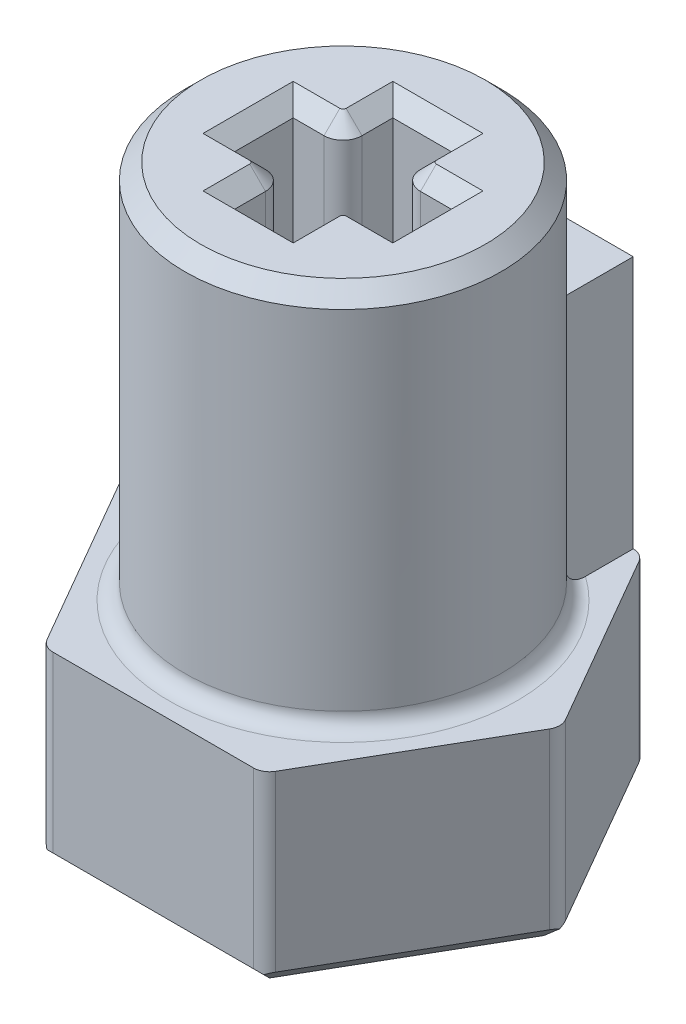
from build123d import *

# Parameters (mm, degrees)
SKETCH_1_R          = 5
EXTRUDE_4_DEPTH     = 12
FILLET_1_R          = 0.6
FILLET_2_R          = 0.6
EXTRUDE_5_DEPTH     = 6
SKETCH_3_R          = 2.55
CUT_EXTRUDE_1_DEPTH = 6
CHAMFER_1_SIZE      = 0.5
CHAMFER_4_SIZE      = 0.5
FILLET_4_R          = 0.5
FILLET_5_R          = 0.5
SKETCH_4_W          = 6.329239392
SKETCH_4_H          = 8
EXTRUDE_6_DEPTH     = 3.5
SKETCH_5_R          = 1.2
CUT_EXTRUDE_2_DEPTH = 3.5
FILLET_7_R          = 0.5


with BuildPart() as part:
    # ｽｹｯﾁ1 → ﾎﾞｽ - 押し出し4 (new body)
    with BuildSketch(Plane(origin=(0, 0, 0), x_dir=(1, 0, 0), z_dir=(0, 1, 0))):
        with Locations(Location((0, 0, 0), (0, 0, 270))):
            Circle(SKETCH_1_R)
        Polygon((-2.5, -0.925), (-2.5, 0.925), (-0.925, 0.925), (-0.925, 2.5), (0.925, 2.5), (0.925, 0.925), (2.5, 0.925), (2.5, -0.925), (0.925, -0.925), (0.925, -2.5), (-0.925, -2.5), (-0.925, -0.925), align=None, mode=Mode.SUBTRACT)
    extrude(amount=EXTRUDE_4_DEPTH)

    # ﾌｨﾚｯﾄ1
    fillet_1_edges = [part.edges().sort_by_distance(p)[0] for p in [
        (0.925, 6, -0.925),
    ]]
    fillet(fillet_1_edges, radius=FILLET_1_R)

    # ﾌｨﾚｯﾄ2
    fillet_2_edges = [part.edges().sort_by_distance(p)[0] for p in [
        (-0.925, 6, -0.925),
        (-0.925, 6, 0.925),
        (0.925, 6, 0.925),
    ]]
    fillet(fillet_2_edges, radius=FILLET_2_R)

    # ｽｹｯﾁ2 → ﾎﾞｽ - 押し出し5 (add)
    with BuildSketch(Plane.XZ):
        Polygon((6.92820323, 0), (3.464101615, 6), (-3.464101615, 6), (-6.92820323, 0), (-3.464101615, -6), (3.464101615, -6), align=None)
    extrude(amount=EXTRUDE_5_DEPTH)

    # ｽｹｯﾁ3 → ｶｯﾄ - 押し出し1 (cut)
    with BuildSketch(Plane.XZ.offset(6)):
        with Locations(Location((0, 0, 0), (0, 0, 270))):
            Circle(SKETCH_3_R)
    extrude(amount=-CUT_EXTRUDE_1_DEPTH, mode=Mode.SUBTRACT)

    # 面取り1
    chamfer_1_edges = [part.edges().sort_by_distance(p)[0] for p in [
        (0, -6, 2.55),
        (5.196152423, -6, -3),
        (5.196152423, -6, 3),
        (0, -6, 6),
        (-5.196152423, -6, 3),
        (-5.196152423, -6, -3),
        (0, -6, -6),
    ]]
    chamfer(chamfer_1_edges, length=CHAMFER_1_SIZE)

    # 面取り4
    chamfer_4_edges = [part.edges().sort_by_distance(p)[0] for p in [
        (2.5, 12, 0),
        (-2.0125, 12, -0.925),
        (-2.0125, 12, 0.925),
        (-2.5, 12, 0),
        (0, 12, -5),
        (2.0125, 12, -0.925),
        (1.100735931, 12, -1.100735931),
        (-0.925, 12, 2.0125),
        (2.0125, 12, 0.925),
        (0.925, 12, 2.0125),
        (1.100735931, 12, 1.100735931),
        (-1.100735931, 12, -1.100735931),
        (-1.100735931, 12, 1.100735931),
        (0.925, 12, -2.0125),
        (0, 12, -2.5),
        (0, 12, 2.5),
        (-0.925, 12, -2.0125),
    ]]
    chamfer(chamfer_4_edges, length=CHAMFER_4_SIZE)

    # ﾌｨﾚｯﾄ4
    fillet_4_edges = [part.edges().sort_by_distance(p)[0] for p in [
        (-3.464101615, -2.75, 6),
    ]]
    fillet(fillet_4_edges, radius=FILLET_4_R)

    # ﾌｨﾚｯﾄ5
    fillet_5_edges = [part.edges().sort_by_distance(p)[0] for p in [
        (3.464101615, -2.75, -6),
        (-3.464101615, -2.75, -6),
        (-6.92820323, -2.75, 0),
        (3.464101615, -2.75, 6),
        (6.92820323, -2.75, 0),
    ]]
    fillet(fillet_5_edges, radius=FILLET_5_R)

    # ｽｹｯﾁ4 → ﾎﾞｽ - 押し出し6 (add)
    with BuildSketch(Plane.XY.offset(-2.5)):
        with Locations((0.010806785, 4)):
            Rectangle(SKETCH_4_W, SKETCH_4_H)
    extrude(amount=-EXTRUDE_6_DEPTH)

    # ｽｹｯﾁ5 → ｶｯﾄ - 押し出し2 (cut)
    with BuildSketch(Plane(origin=(0, 0, -6), x_dir=(-1, 0, 0), z_dir=(0, 0, -1))):
        with Locations((0, 5)):
            Circle(SKETCH_5_R)
    extrude(amount=-CUT_EXTRUDE_2_DEPTH, mode=Mode.SUBTRACT)

    # ﾌｨﾚｯﾄ7
    fillet_7_edges = [part.edges().sort_by_distance(p)[0] for p in [
        (-4.7116556, 0, 1.673410144),
    ]]
    fillet(fillet_7_edges, radius=FILLET_7_R)


solid = part.part
